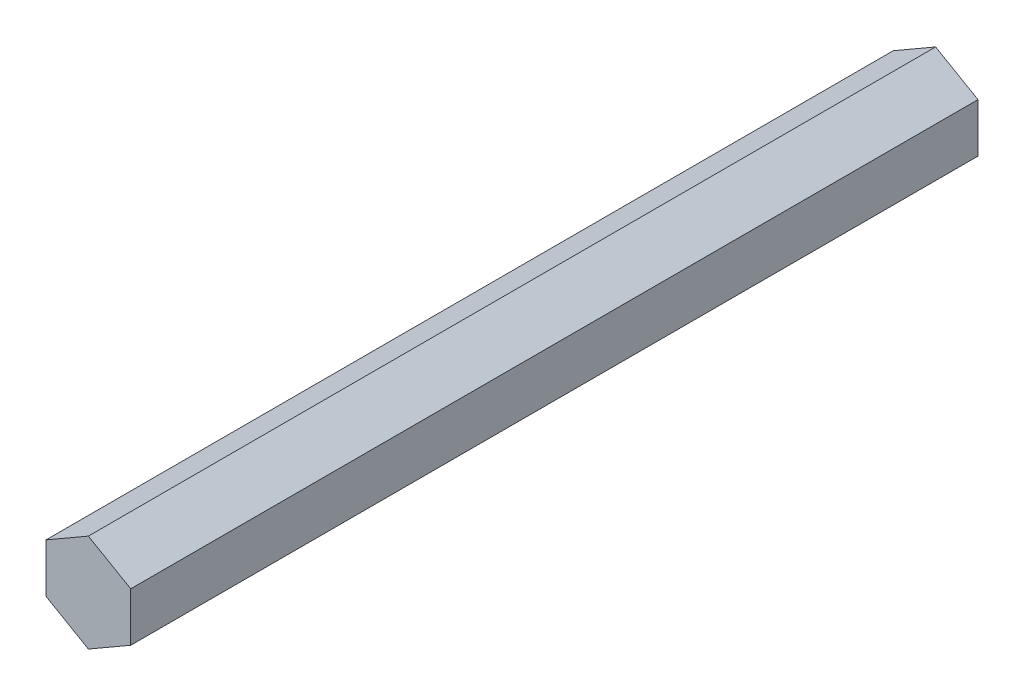
from build123d import *

# Parameters (mm, degrees)
BOSS_EXTRUDE1_DEPTH = 127


with BuildPart() as part:
    # Sketch2 → Boss-Extrude1 (new body)
    with BuildSketch(Plane.XY):
        Polygon((0, -7.332348419), (6.35, -3.666174209), (6.35, 3.666174209), (0, 7.332348419), (-6.35, 3.666174209), (-6.35, -3.666174209), align=None)
    extrude(amount=BOSS_EXTRUDE1_DEPTH)


solid = part.part
